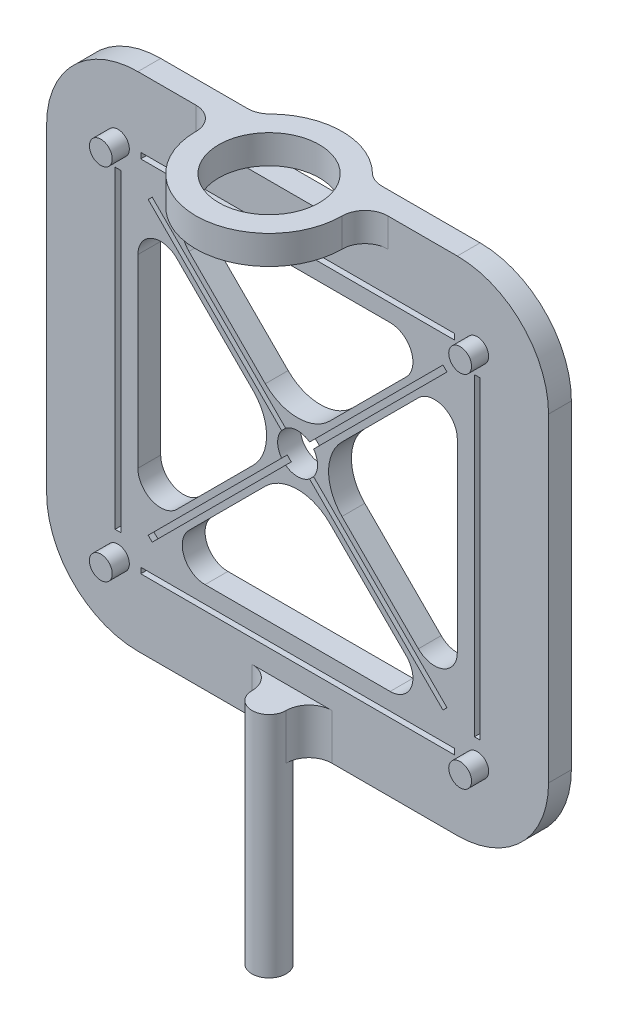
from build123d import *

# Parameters (mm, degrees)
BOSS_EXTRUDE2_DEPTH     = 6.35
CUT_EXTRUDE1_DEPTH      = 198.667656687
CUT_EXTRUDE1_DEPTH_BACK = 198.667656687
SKETCH2_R               = 5.55625
CUT_EXTRUDE2_DEPTH      = 198.667656687
CUT_EXTRUDE2_DEPTH_BACK = 1.5875
SKETCH3_W               = 1.5875
SKETCH3_H               = 87.3
SKETCH3_3_R             = 3.175
BOSS_EXTRUDE3_DEPTH     = 4.7625
SKETCH6_R               = 14
BOSS_EXTRUDE7_DEPTH     = 8
BOSS_EXTRUDE8_START     = -139.7
BOSS_EXTRUDE8_DEPTH     = 12.7
BOSS_EXTRUDE9_START     = 50.8
SKETCH12_R              = 4.7625
BOSS_EXTRUDE9_DEPTH     = 50.8
SKETCH13_R              = 14
CUT_EXTRUDE3_DEPTH      = 8


with BuildPart() as part:
    # Sketch1 → Boss-Extrude2 (new body)
    with BuildSketch(Plane.XY):
        with BuildLine():
            Line((-25.4, 0), (-114.3, 0))
            ThreePointArc((-114.3, 0), (-132.260512242, -7.439487758), (-139.7, -25.4))
            Line((-139.7, -25.4), (-139.7, -114.3))
            ThreePointArc((-139.7, -114.3), (-132.260512242, -132.260512242), (-114.3, -139.7))
            Line((-114.3, -139.7), (-25.4, -139.7))
            ThreePointArc((-25.4, -139.7), (-7.439487758, -132.260512242), (0, -114.3))
            Line((0, -114.3), (0, -25.4))
            ThreePointArc((0, -25.4), (-7.439487758, -7.439487758), (-25.4, 0))
        make_face()
    extrude(amount=BOSS_EXTRUDE2_DEPTH)

    # Sketch2 → Cut-Extrude1 (cut, two sides: drawn at the far end of the back side and taken through both)
    with BuildSketch(Plane.XY.offset(6.35).offset(-CUT_EXTRUDE1_DEPTH_BACK)):
        with Locations((-69.85, -69.85)):
            Circle(SKETCH2_R)
        with BuildLine():
            Line((-95.602147834, -25.4), (-44.097852166, -25.4))
            ThreePointArc((-44.097852166, -25.4), (-38.231217135, -29.319960204), (-39.607724106, -36.240128061))
            Line((-39.607724106, -36.240128061), (-60.869743879, -57.502147834))
            ThreePointArc((-60.869743879, -57.502147834), (-69.85, -61.221891712), (-78.830256121, -57.502147834))
            Line((-78.830256121, -57.502147834), (-100.092275894, -36.240128061))
            ThreePointArc((-100.092275894, -36.240128061), (-101.468782865, -29.319960204), (-95.602147834, -25.4))
        make_face()
        with BuildLine():
            Line((-57.502147834, -78.830256121), (-36.240128061, -100.092275894))
            ThreePointArc((-36.240128061, -100.092275894), (-29.319960204, -101.468782865), (-25.4, -95.602147834))
            Line((-25.4, -95.602147834), (-25.4, -44.097852166))
            ThreePointArc((-25.4, -44.097852166), (-29.319960204, -38.231217135), (-36.240128061, -39.607724106))
            Line((-36.240128061, -39.607724106), (-57.502147834, -60.869743879))
            ThreePointArc((-57.502147834, -60.869743879), (-61.221891712, -69.85), (-57.502147834, -78.830256121))
        make_face()
        with BuildLine():
            Line((-78.830256121, -82.197852166), (-100.092275894, -103.459871939))
            ThreePointArc((-100.092275894, -103.459871939), (-101.468782865, -110.380039796), (-95.602147834, -114.3))
            Line((-95.602147834, -114.3), (-44.097852166, -114.3))
            ThreePointArc((-44.097852166, -114.3), (-38.231217135, -110.380039796), (-39.607724106, -103.459871939))
            Line((-39.607724106, -103.459871939), (-60.869743879, -82.197852166))
            ThreePointArc((-60.869743879, -82.197852166), (-69.85, -78.478108288), (-78.830256121, -82.197852166))
        make_face()
        with BuildLine():
            Line((-82.197852166, -60.869743879), (-103.459871939, -39.607724106))
            ThreePointArc((-103.459871939, -39.607724106), (-110.380039796, -38.231217135), (-114.3, -44.097852166))
            Line((-114.3, -44.097852166), (-114.3, -95.602147834))
            ThreePointArc((-114.3, -95.602147834), (-110.380039796, -101.468782865), (-103.459871939, -100.092275894))
            Line((-103.459871939, -100.092275894), (-82.197852166, -78.830256121))
            ThreePointArc((-82.197852166, -78.830256121), (-78.478108288, -69.85), (-82.197852166, -60.869743879))
        make_face()
    extrude(amount=CUT_EXTRUDE1_DEPTH + CUT_EXTRUDE1_DEPTH_BACK, mode=Mode.SUBTRACT)

    # Sketch3 → Cut-Extrude2 (cut, two sides: drawn at the far end of the back side and taken through both)
    with BuildSketch(Plane.XY.offset(6.35).offset(-CUT_EXTRUDE2_DEPTH_BACK)):
        Polygon((-26.2, -119.05625), (-69.85, -119.05625), (-113.5, -119.05625), (-113.5, -120.64375), (-26.2, -120.64375), align=None)
        Polygon((-29.391522129, -28.268990114), (-69.85, -68.727467985), (-68.727467985, -69.85), (-28.268990114, -29.391522129), align=None)
        Polygon((-70.972532015, -69.85), (-69.85, -68.727467985), (-110.308477871, -28.268990114), (-111.431009886, -29.391522129), align=None)
        Polygon((-113.5, -20.64375), (-69.85, -20.64375), (-26.2, -20.64375), (-26.2, -19.05625), (-113.5, -19.05625), align=None)
        Polygon((-110.308477871, -111.431009886), (-69.85, -70.972532015), (-70.972532015, -69.85), (-111.431009886, -110.308477871), align=None)
        Polygon((-68.727467985, -69.85), (-69.85, -70.972532015), (-29.391522129, -111.431009886), (-28.268990114, -110.308477871), align=None)
        with Locations((-119.85, -69.85)):
            Rectangle(SKETCH3_W, SKETCH3_H)
        with Locations((-19.85, -69.85)):
            Rectangle(SKETCH3_W, SKETCH3_H)
    extrude(amount=CUT_EXTRUDE2_DEPTH + CUT_EXTRUDE2_DEPTH_BACK, mode=Mode.SUBTRACT)

    # Sketch3<3> → Boss-Extrude3 (add)
    with BuildSketch(Plane.XY.offset(6.35)):
        with Locations(Location((-119.85, -19.85, 0), (0, 0, 180))):
            Circle(SKETCH3_3_R)
        with Locations(Location((-19.85, -19.85, 0), (0, 0, 180))):
            Circle(SKETCH3_3_R)
        with Locations(Location((-19.85, -119.85, 0), (0, 0, 180))):
            Circle(SKETCH3_3_R)
        with Locations(Location((-119.85, -119.85, 0), (0, 0, 180))):
            Circle(SKETCH3_3_R)
    extrude(amount=BOSS_EXTRUDE3_DEPTH)

    # Sketch6 → Boss-Extrude7 (add)
    with BuildSketch(Plane(origin=(0, 0, 0), x_dir=(1, 0, 0), z_dir=(0, 1, 0))):
        with BuildLine():
            Line((-98.1375, -6.35), (-90.771408037, -6.35))
            ThreePointArc((-90.771408037, -6.35), (-89.338621713, -3.021552737), (-87.338207531, 0))
            Line((-87.338207531, 0), (-90.145452854, 0))
            ThreePointArc((-90.145452854, 0), (-87.742009924, 0.472418688), (-85.696183168, 1.819382022))
            ThreePointArc((-85.696183168, 1.819382022), (-71.4375, 7.65), (-57.178816832, 1.819382022))
            ThreePointArc((-57.178816832, 1.819382022), (-55.132990076, 0.472418688), (-52.729547146, 0))
            Line((-52.729547146, 0), (-55.536792469, 0))
            ThreePointArc((-55.536792469, 0), (-53.536378287, -3.021552737), (-52.103591963, -6.35))
            Line((-52.103591963, -6.35), (-44.7375, -6.35))
            ThreePointArc((-44.7375, -6.35), (-49.227628061, -8.209871939), (-51.0875, -12.7))
            ThreePointArc((-51.0875, -12.7), (-71.4375, -33.05), (-91.7875, -12.7))
            ThreePointArc((-91.7875, -12.7), (-93.647371939, -8.209871939), (-98.1375, -6.35))
        make_face()
        with Locations((-71.4375, -12.7)):
            Circle(SKETCH6_R, mode=Mode.SUBTRACT)
    extrude(amount=-BOSS_EXTRUDE7_DEPTH)

    # Sketch5 → Boss-Extrude8 (add)
    with BuildSketch(Plane(origin=(0, 0, 0), x_dir=(1, 0, 0), z_dir=(0, 1, 0)).offset(BOSS_EXTRUDE8_START)):
        with BuildLine():
            Line((-82.55, -6.35), (-60.325, -6.35))
            ThreePointArc((-60.325, -6.35), (-64.815128061, -8.209871939), (-66.675, -12.7))
            ThreePointArc((-66.675, -12.7), (-71.4375, -17.4625), (-76.2, -12.7))
            ThreePointArc((-76.2, -12.7), (-78.059871939, -8.209871939), (-82.55, -6.35))
        make_face()
    extrude(amount=BOSS_EXTRUDE8_DEPTH)

    # Sketch12 → Boss-Extrude9 (add)
    with BuildSketch(Plane.XZ.offset(139.7).offset(BOSS_EXTRUDE9_START)):
        with Locations((-71.4375, 12.7)):
            Circle(SKETCH12_R)
    extrude(amount=-BOSS_EXTRUDE9_DEPTH)

    # Sketch13 → Cut-Extrude3 (cut)
    with BuildSketch(Plane(origin=(0, 0, 0), x_dir=(1, 0, 0), z_dir=(0, 1, 0))):
        with Locations(Location((-71.4375, -12.7, 0), (0, 0, 270))):
            Circle(SKETCH13_R)
    extrude(amount=-CUT_EXTRUDE3_DEPTH, mode=Mode.SUBTRACT)


solid = part.part
